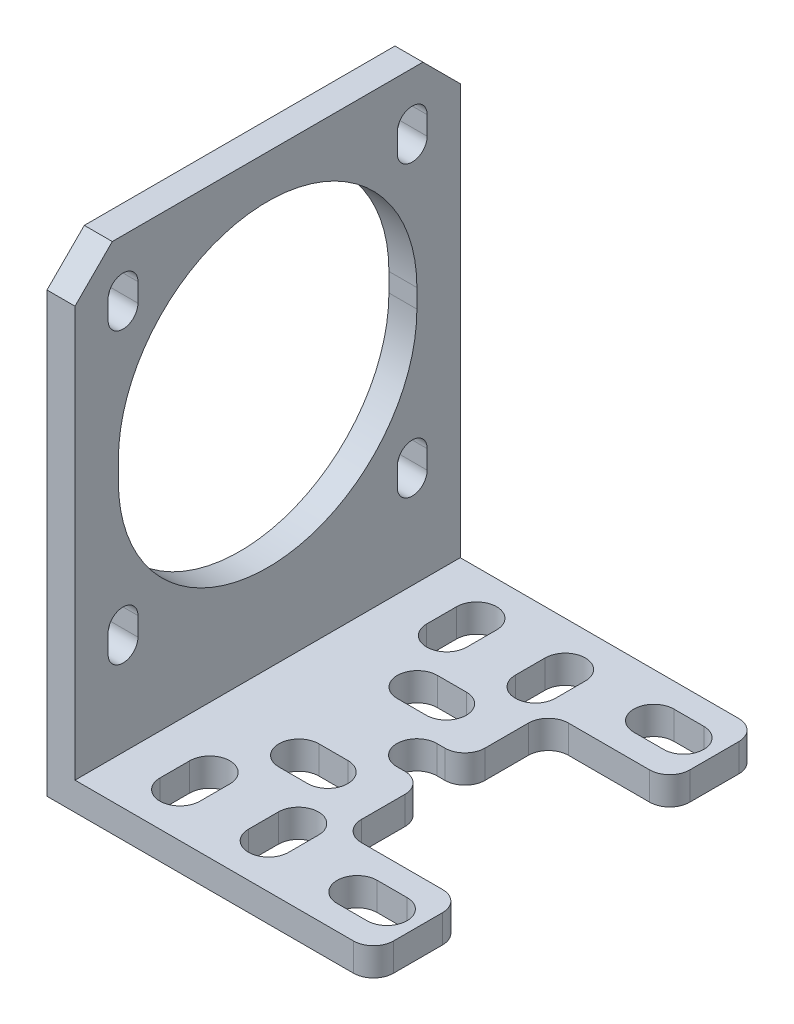
from build123d import *

# Parameters (mm, degrees)
BOSS_EXTRUDE1_DEPTH = 3
SKETCH2_W           = 3
SKETCH2_H           = 41.3
BOSS_EXTRUDE2_DEPTH = 48
CUT_EXTRUDE1_DEPTH  = 48
CHAMFER1_SIZE       = 4


with BuildPart() as part:
    # Sketch1 → Boss-Extrude1 (new body)
    with BuildSketch(Plane(origin=(0, 0, 0), x_dir=(1, 0, 0), z_dir=(0, 1, 0))):
        with BuildLine():
            Line((15.35, 20.65), (-17.5, 20.65))
            Line((-17.5, 20.65), (-17.5, -20.65))
            Line((-17.5, -20.65), (15.35, -20.65))
            ThreePointArc((15.35, -20.65), (16.87027958, -20.02027958), (17.5, -18.5))
            Line((17.5, -18.5), (17.5, -13.25))
            ThreePointArc((17.5, -13.25), (16.87027958, -11.72972042), (15.35, -11.1))
            Line((15.35, -11.1), (6.65, -11.1))
            ThreePointArc((6.65, -11.1), (5.12972042, -10.47027958), (4.5, -8.95))
            Line((4.5, -8.95), (4.5, -4.3))
            ThreePointArc((4.5, -4.3), (3.87027958, -2.77972042), (2.35, -2.15))
            Line((2.35, -2.15), (1.5, -2.15))
            ThreePointArc((1.5, -2.15), (-0.65, 0), (1.5, 2.15))
            Line((1.5, 2.15), (2.35, 2.15))
            ThreePointArc((2.35, 2.15), (3.87027958, 2.77972042), (4.5, 4.3))
            Line((4.5, 4.3), (4.5, 8.95))
            ThreePointArc((4.5, 8.95), (5.12972042, 10.47027958), (6.65, 11.1))
            Line((6.65, 11.1), (15.35, 11.1))
            ThreePointArc((15.35, 11.1), (16.87027958, 11.72972042), (17.5, 13.25))
            Line((17.5, 13.25), (17.5, 18.5))
            ThreePointArc((17.5, 18.5), (16.87027958, 20.02027958), (15.35, 20.65))
        make_face()
        with BuildLine():
            Line((-5.85, -12.7), (-5.85, -15.9))
            ThreePointArc((-5.85, -15.9), (-8, -18.05), (-10.15, -15.9))
            Line((-10.15, -15.9), (-10.15, -12.7))
            ThreePointArc((-10.15, -12.7), (-8, -10.55), (-5.85, -12.7))
        make_face(mode=Mode.SUBTRACT)
        with BuildLine():
            Line((-1.7, -8.5), (-4.8, -8.5))
            ThreePointArc((-4.8, -8.5), (-6.95, -6.35), (-4.8, -4.2))
            Line((-4.8, -4.2), (-1.7, -4.2))
            ThreePointArc((-1.7, -4.2), (0.45, -6.35), (-1.7, -8.5))
        make_face(mode=Mode.SUBTRACT)
        with BuildLine():
            Line((3.65, -12.7), (3.65, -15.9))
            ThreePointArc((3.65, -15.9), (1.5, -18.05), (-0.65, -15.9))
            Line((-0.65, -15.9), (-0.65, -12.7))
            ThreePointArc((-0.65, -12.7), (1.5, -10.55), (3.65, -12.7))
        make_face(mode=Mode.SUBTRACT)
        with BuildLine():
            Line((14.2, -18.05), (11, -18.05))
            ThreePointArc((11, -18.05), (8.85, -15.9), (11, -13.75))
            Line((11, -13.75), (14.2, -13.75))
            ThreePointArc((14.2, -13.75), (16.35, -15.9), (14.2, -18.05))
        make_face(mode=Mode.SUBTRACT)
        with BuildLine():
            ThreePointArc((-4.8, 4.2), (-6.95, 6.35), (-4.8, 8.5))
            Line((-4.8, 8.5), (-1.7, 8.5))
            ThreePointArc((-1.7, 8.5), (0.45, 6.35), (-1.7, 4.2))
            Line((-1.7, 4.2), (-4.8, 4.2))
        make_face(mode=Mode.SUBTRACT)
        with BuildLine():
            ThreePointArc((-10.15, 15.9), (-8, 18.05), (-5.85, 15.9))
            Line((-5.85, 15.9), (-5.85, 12.7))
            ThreePointArc((-5.85, 12.7), (-7.123986993, 10.736558834), (-9.436140662, 11.1))
            ThreePointArc((-9.436140662, 11.1), (-9.963441166, 11.823986993), (-10.15, 12.7))
            Line((-10.15, 12.7), (-10.15, 15.9))
        make_face(mode=Mode.SUBTRACT)
        with BuildLine():
            ThreePointArc((-0.65, 15.9), (1.5, 18.05), (3.65, 15.9))
            Line((3.65, 15.9), (3.65, 12.7))
            ThreePointArc((3.65, 12.7), (1.5, 10.55), (-0.65, 12.7))
            Line((-0.65, 12.7), (-0.65, 15.9))
        make_face(mode=Mode.SUBTRACT)
        with BuildLine():
            ThreePointArc((11, 13.75), (8.85, 15.9), (11, 18.05))
            Line((11, 18.05), (14.2, 18.05))
            ThreePointArc((14.2, 18.05), (16.35, 15.9), (14.2, 13.75))
            Line((14.2, 13.75), (11, 13.75))
        make_face(mode=Mode.SUBTRACT)
    extrude(amount=BOSS_EXTRUDE1_DEPTH)

    # Sketch2 → Boss-Extrude2 (add)
    with BuildSketch(Plane(origin=(0, 3, 0), x_dir=(1, 0, 0), z_dir=(0, 1, 0))):
        with Locations((-16, 0)):
            Rectangle(SKETCH2_W, SKETCH2_H)
    extrude(amount=BOSS_EXTRUDE2_DEPTH)

    # Sketch3 → Cut-Extrude1 (cut)
    with BuildSketch(Plane(origin=(-14.5, 0, 0), x_dir=(0, 0, -1), z_dir=(1, 0, 0))):
        with BuildLine():
            Line((-16, 30.4), (-16, 28.4))
            ThreePointArc((-16, 28.4), (0, 12.4), (16, 28.4))
            Line((16, 28.4), (16, 30.4))
            ThreePointArc((16, 30.4), (0, 46.4), (-16, 30.4))
        make_face()
        with BuildLine():
            Line((17.1, 45.9), (17.1, 43.9))
            ThreePointArc((17.1, 43.9), (15.5, 42.3), (13.9, 43.9))
            Line((13.9, 43.9), (13.9, 45.9))
            ThreePointArc((13.9, 45.9), (15.5, 47.5), (17.1, 45.9))
        make_face()
        with BuildLine():
            Line((-17.1, 45.9), (-17.1, 43.9))
            ThreePointArc((-17.1, 43.9), (-15.5, 42.3), (-13.9, 43.9))
            Line((-13.9, 43.9), (-13.9, 45.9))
            ThreePointArc((-13.9, 45.9), (-15.5, 47.5), (-17.1, 45.9))
        make_face()
        with BuildLine():
            Line((17.1, 12.9), (17.1, 14.9))
            ThreePointArc((17.1, 14.9), (15.5, 16.5), (13.9, 14.9))
            Line((13.9, 14.9), (13.9, 12.9))
            ThreePointArc((13.9, 12.9), (15.5, 11.3), (17.1, 12.9))
        make_face()
        with BuildLine():
            Line((-17.1, 12.9), (-17.1, 14.9))
            ThreePointArc((-17.1, 14.9), (-15.5, 16.5), (-13.9, 14.9))
            Line((-13.9, 14.9), (-13.9, 12.9))
            ThreePointArc((-13.9, 12.9), (-15.5, 11.3), (-17.1, 12.9))
        make_face()
    extrude(amount=-CUT_EXTRUDE1_DEPTH, mode=Mode.SUBTRACT)

    # Chamfer1
    chamfer1_edges = [part.edges().sort_by_distance(p)[0] for p in [
        (-16, 51, 20.65),
        (-16, 51, -20.65),
    ]]
    chamfer(chamfer1_edges, length=CHAMFER1_SIZE)


solid = part.part
